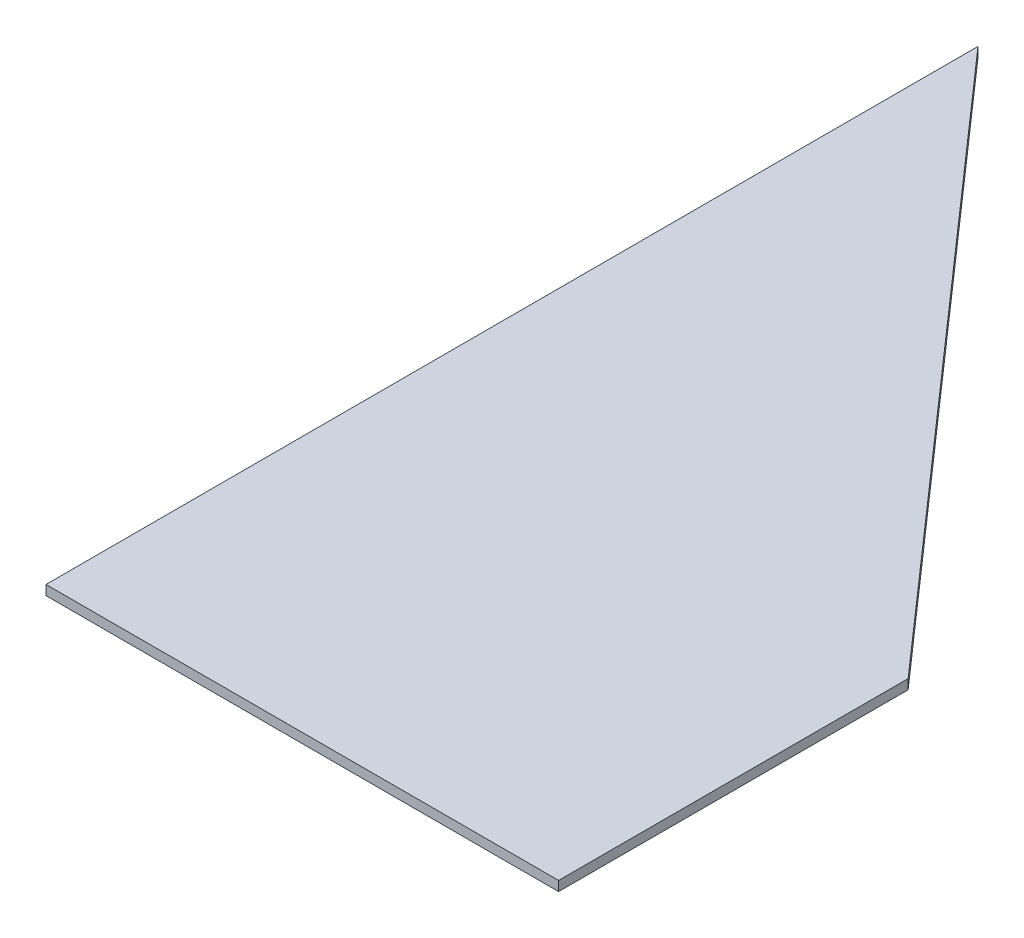
from build123d import *

# Parameters (mm, degrees)
BOSS_EXTRUDE1_DEPTH = 3.175


with BuildPart() as part:
    # Sketch1 → Boss-Extrude1 (new body)
    with BuildSketch(Plane(origin=(0, 0, 0), x_dir=(1, 0, 0), z_dir=(0, 1, 0))):
        Polygon((0, 0), (167.64, 0), (167.64, 114.3), (0, 304.8), align=None)
    extrude(amount=BOSS_EXTRUDE1_DEPTH)


solid = part.part
